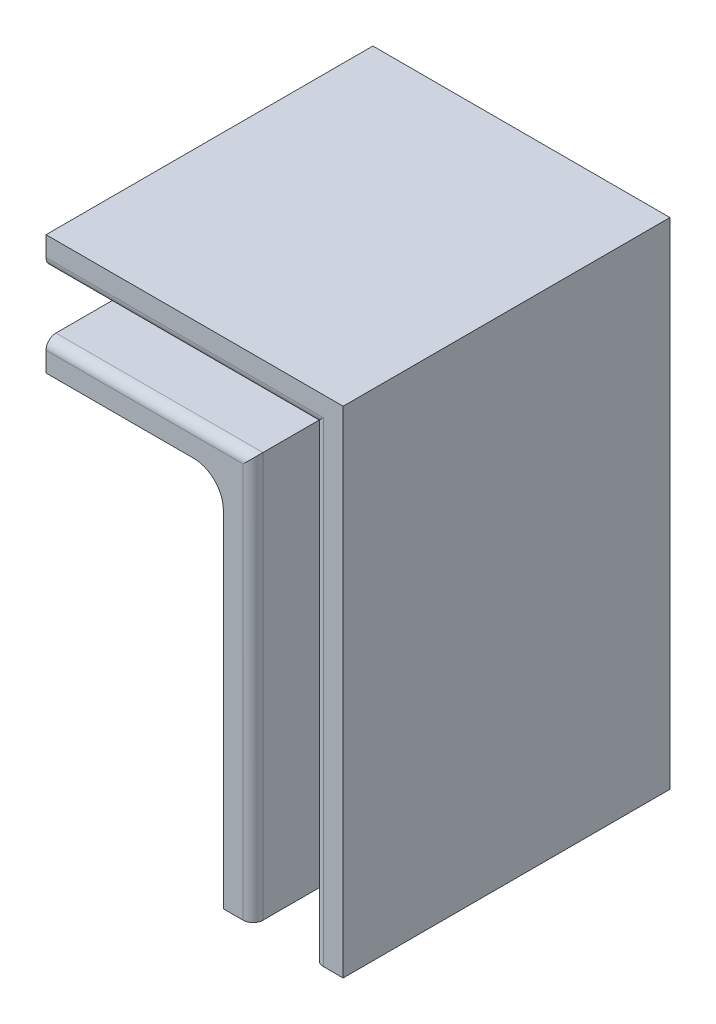
from build123d import *

# Parameters (mm, degrees)
SKETCH1_W           = 30
SKETCH1_H           = 50
BOSS_EXTRUDE1_DEPTH = 3
BOSS_EXTRUDE2_DEPTH = 30
FILLET1_R           = 3
FILLET2_R           = 1


with BuildPart() as part:
    # Sketch1 → Boss-Extrude1 (new body)
    with BuildSketch(Plane.XY):
        with Locations((15, 25)):
            Rectangle(SKETCH1_W, SKETCH1_H)
    extrude(amount=BOSS_EXTRUDE1_DEPTH)

    # Sketch2 → Boss-Extrude2 (add)
    with BuildSketch(Plane.XY.offset(3)):
        Polygon((0, 50), (30, 50), (30, 0), (27, 0), (27, 47), (0, 47), align=None)
        Polygon((0, 40.9), (20.9, 40.9), (20.9, 0), (17.9, 0), (17.9, 37.9), (0, 37.9), align=None)
    extrude(amount=BOSS_EXTRUDE2_DEPTH)

    # Fillet1
    fillet1_edges = [part.edges().sort_by_distance(p)[0] for p in [
        (13.5, 47, 3),
        (27, 23.5, 3),
        (8.95, 37.9, 3),
        (17.9, 18.95, 3),
        (17.9, 37.9, 18),
        (20.9, 20.45, 3),
        (10.45, 40.9, 3),
    ]]
    fillet(fillet1_edges, radius=FILLET1_R)

    # Fillet2
    fillet2_edges = [part.edges().sort_by_distance(p)[0] for p in [
        (13.5, 47, 33),
        (27, 23.5, 33),
        (20.9, 20.45, 33),
        (10.45, 40.9, 33),
    ]]
    fillet(fillet2_edges, radius=FILLET2_R)


solid = part.part
